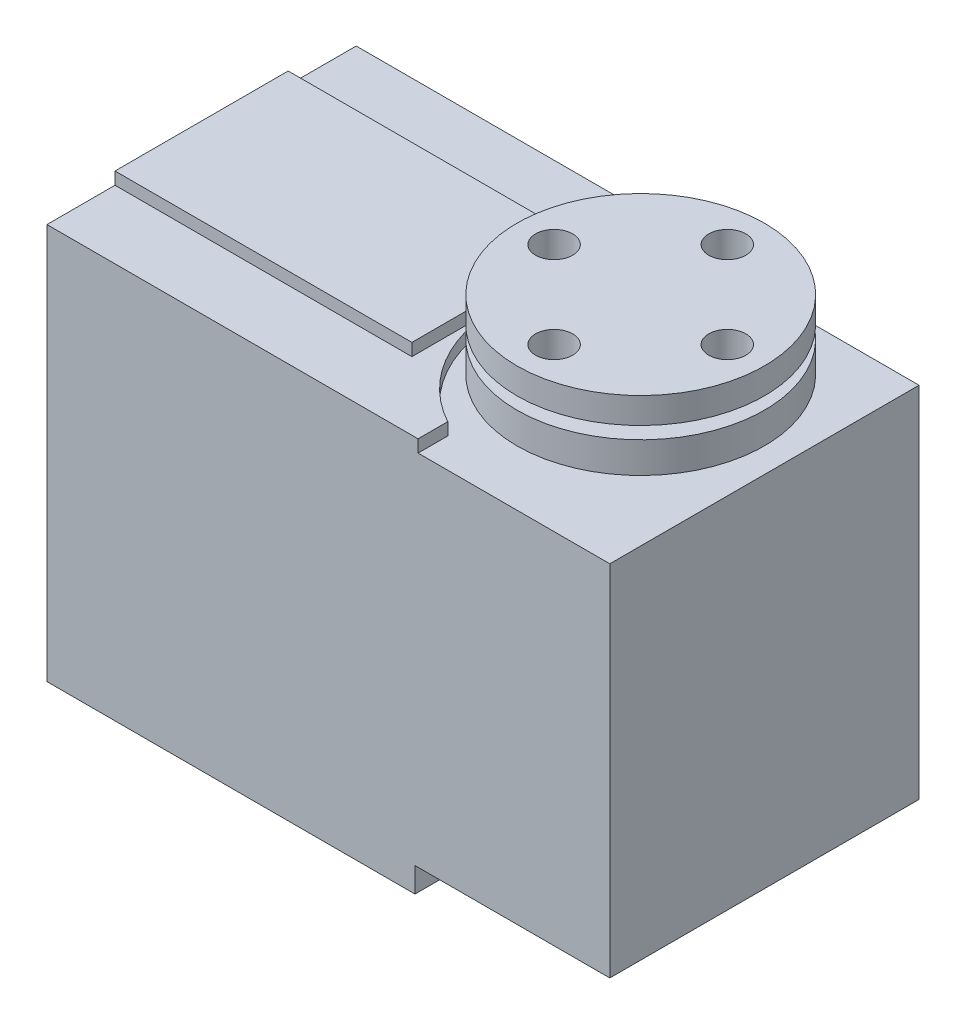
from build123d import *

# Parameters (mm, degrees)
MAIN_BODY_SKETCH_W        = 45.5
MAIN_BODY_SKETCH_H        = 25
MAIN_BODY_EXTRUSION_DEPTH = 29
BOSS_EXTRUDE3_DEPTH       = 1
SKETCH8_W                 = 24
SKETCH8_H                 = 14
BOSS_EXTRUDE8_DEPTH       = 1
SKETCH3_R                 = 2.25
BOSS_EXTRUDE4_DEPTH       = 2
SKETCH6_R                 = 10
BOSS_EXTRUDE7_DEPTH       = 2.5
SKETCH7_R                 = 1.5
CUT_EXTRUDE1_DEPTH        = 2
SKETCH10_R                = 2.25
BOSS_EXTRUDE12_DEPTH      = 1
SKETCH11_R                = 10
BOSS_EXTRUDE13_DEPTH      = 2.1
SKETCH13_R                = 1.5
CUT_EXTRUDE3_DEPTH        = 2.1
BOSS_EXTRUDE9_DEPTH       = 2
SKETCH9_W                 = 5
SKETCH9_H                 = 20
CUT_EXTRUDE2_DEPTH        = 5
SKETCH4_R                 = 3
SKETCH4_R_2               = 1.25
BOSS_EXTRUDE10_DEPTH      = 4.1
SKETCH14_W                = 13.5
SKETCH14_H                = 17.856103011
BOSS_EXTRUDE14_DEPTH      = 2


with BuildPart() as part:
    # Main Body Sketch → Main Body Extrusion (new body)
    with BuildSketch(Plane(origin=(0, 0, 0), x_dir=(1, 0, 0), z_dir=(0, 1, 0))):
        Rectangle(MAIN_BODY_SKETCH_W, MAIN_BODY_SKETCH_H)
    extrude(amount=MAIN_BODY_EXTRUSION_DEPTH)

    # Sketch2 → Boss-Extrude3 (add)
    with BuildSketch(Plane(origin=(0, 29, 0), x_dir=(1, 0, 0), z_dir=(0, 1, 0))):
        with BuildLine():
            Line((-22.75, 12.5), (7.25, 12.5))
            Line((7.25, 12.5), (7.25, 10.099504938))
            ThreePointArc((7.25, 10.099504938), (1.25, 0), (7.25, -10.099504938))
            Line((7.25, -10.099504938), (7.25, -12.5))
            Line((7.25, -12.5), (-22.75, -12.5))
            Line((-22.75, -12.5), (-22.75, 12.5))
        make_face()
    extrude(amount=BOSS_EXTRUDE3_DEPTH)

    # Sketch8 → Boss-Extrude8 (add)
    with BuildSketch(Plane(origin=(0, 30, 0), x_dir=(1, 0, 0), z_dir=(0, 1, 0))):
        with Locations((-10.75, 0)):
            Rectangle(SKETCH8_W, SKETCH8_H)
    extrude(amount=BOSS_EXTRUDE8_DEPTH)

    # Sketch3 → Boss-Extrude4 (add)
    with BuildSketch(Plane(origin=(0, 29, 0), x_dir=(1, 0, 0), z_dir=(0, 1, 0))):
        with Locations(Location((12.75, 0, 0), (0, 0, 270))):
            Circle(SKETCH3_R)
    extrude(amount=BOSS_EXTRUDE4_DEPTH)

    # Sketch6 → Boss-Extrude7 (add)
    with BuildSketch(Plane(origin=(0, 31, 0), x_dir=(1, 0, 0), z_dir=(0, 1, 0))):
        with Locations(Location((12.75, 0, 0), (0, 0, 270))):
            Circle(SKETCH6_R)
    extrude(amount=BOSS_EXTRUDE7_DEPTH)

    # Sketch7 → Cut-Extrude1 (cut)
    with BuildSketch(Plane(origin=(0, 33.5, 0), x_dir=(1, 0, 0), z_dir=(0, 1, 0))):
        with Locations(Location((12.75, 7, 0), (0, 0, 270))):
            Circle(SKETCH7_R)
        with Locations(Location((12.75, -7, 0), (0, 0, 90))):
            Circle(SKETCH7_R)
        with Locations(Location((5.75, 0, 0), (0, 0, 270))):
            Circle(SKETCH7_R)
        with Locations(Location((19.75, 0, 0), (0, 0, 90))):
            Circle(SKETCH7_R)
    extrude(amount=-CUT_EXTRUDE1_DEPTH, mode=Mode.SUBTRACT)

    # Sketch10 → Boss-Extrude12 (add)
    with BuildSketch(Plane(origin=(0, 33.5, 0), x_dir=(1, 0, 0), z_dir=(0, 1, 0))):
        with Locations(Location((12.75, 0, 0), (0, 0, 270))):
            Circle(SKETCH10_R)
    extrude(amount=BOSS_EXTRUDE12_DEPTH)

    # Sketch11 → Boss-Extrude13 (add)
    with BuildSketch(Plane(origin=(0, 34.5, 0), x_dir=(1, 0, 0), z_dir=(0, 1, 0))):
        with Locations(Location((12.75, 0, 0), (0, 0, 270))):
            Circle(SKETCH11_R)
    extrude(amount=BOSS_EXTRUDE13_DEPTH)

    # Sketch13 → Cut-Extrude3 (cut)
    with BuildSketch(Plane(origin=(0, 36.6, 0), x_dir=(1, 0, 0), z_dir=(0, 1, 0))):
        with Locations(Location((12.75, 7, 0), (0, 0, 270))):
            Circle(SKETCH13_R)
        with Locations(Location((5.75, 0, 0), (0, 0, 270))):
            Circle(SKETCH13_R)
        with Locations(Location((12.75, -7, 0), (0, 0, 90))):
            Circle(SKETCH13_R)
        with Locations(Location((19.75, 0, 0), (0, 0, 90))):
            Circle(SKETCH13_R)
    extrude(amount=-CUT_EXTRUDE3_DEPTH, mode=Mode.SUBTRACT)

    # Sketch5 → Boss-Extrude9 (add)
    with BuildSketch(Plane.XZ):
        Polygon((-4, 12.5), (-22.75, 12.5), (-22.75, -12.5), (-4, -12.5), (-4, -10), (-4, 0), (-4, 10), align=None)
        Polygon((7, 12.5), (-4, 12.5), (-4, 10), (1, 10), (1, 6.5), (3.5, 6.5), (7, 10), align=None)
        Polygon((-4, -10), (-4, -12.5), (7, -12.5), (7, -10), (3.5, -6.5), (1, -6.5), (1, -10), align=None)
    extrude(amount=BOSS_EXTRUDE9_DEPTH)

    # Sketch9 → Cut-Extrude2 (cut)
    with BuildSketch(Plane.XZ):
        with Locations((-1.5, 0)):
            Rectangle(SKETCH9_W, SKETCH9_H)
    extrude(amount=-CUT_EXTRUDE2_DEPTH, mode=Mode.SUBTRACT)

    # Sketch4 → Boss-Extrude10 (add)
    with BuildSketch(Plane.XZ):
        with Locations(Location((12.5, 0, 0), (0, 0, 90))):
            Circle(SKETCH4_R)
        with Locations(Location((12.5, 0, 0), (0, 0, 270))):
            Circle(SKETCH4_R_2, mode=Mode.SUBTRACT)
    extrude(amount=BOSS_EXTRUDE10_DEPTH)

    # Sketch14 → Boss-Extrude14 (add)
    with BuildSketch(Plane.XZ.offset(2)):
        with Locations((-10.75, -0.020714737)):
            Rectangle(SKETCH14_W, SKETCH14_H)
    extrude(amount=BOSS_EXTRUDE14_DEPTH)


solid = part.part
